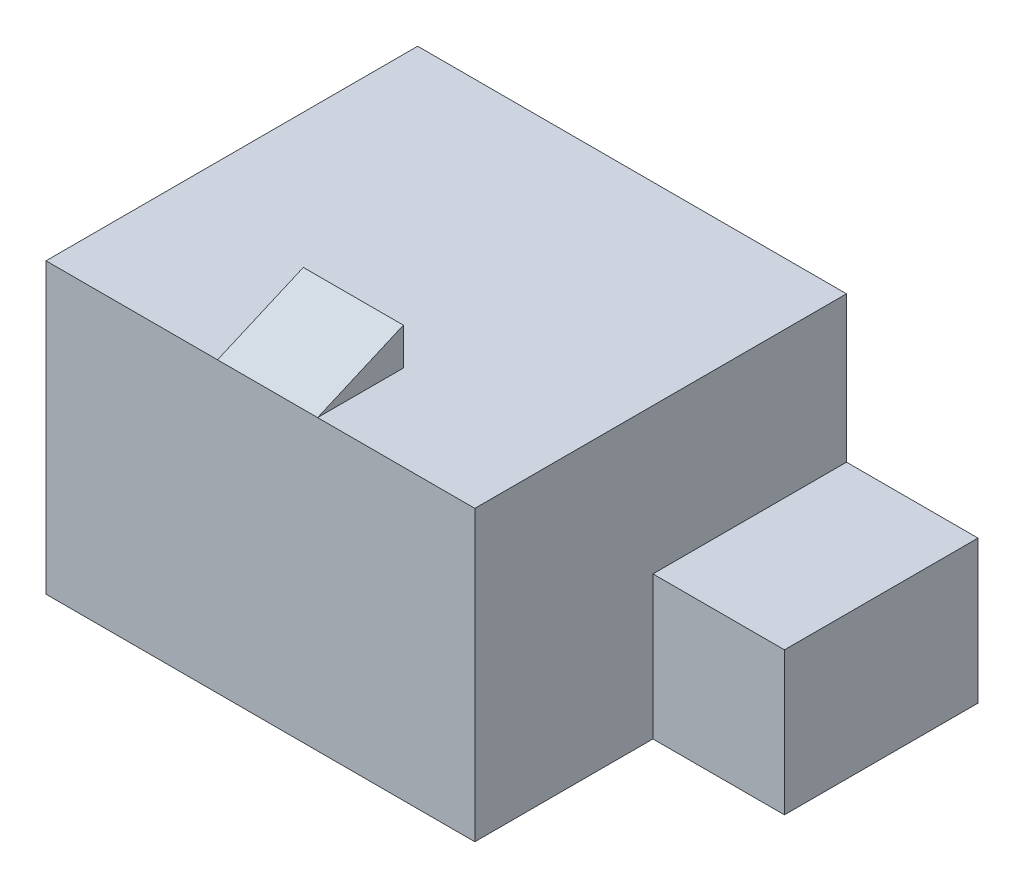
from build123d import *

# Parameters (mm, degrees)
SKETCH1_W           = 15
SKETCH1_H           = 13
BOSS_EXTRUDE1_DEPTH = 10.1
SKETCH2_W           = 3.5
SKETCH2_H           = 3
BOSS_EXTRUDE2_DEPTH = 1.3
CUT_EXTRUDE1_REACH  = 21.728
SKETCH4_W           = 6.77
SKETCH4_H           = 5
BOSS_EXTRUDE3_DEPTH = 4.6
SKETCH5_W           = 6.77
SKETCH5_H           = 5
BOSS_EXTRUDE4_DEPTH = 4.6


with BuildPart() as part:
    # Sketch1 → Boss-Extrude1 (new body)
    with BuildSketch(Plane(origin=(0, 0, 0), x_dir=(1, 0, 0), z_dir=(0, 1, 0))):
        with Locations((7.5, 6.5)):
            Rectangle(SKETCH1_W, SKETCH1_H)
    extrude(amount=BOSS_EXTRUDE1_DEPTH)

    # Sketch2 → Boss-Extrude2 (add)
    with BuildSketch(Plane(origin=(0, 10.1, 0), x_dir=(1, 0, 0), z_dir=(0, 1, 0))):
        with Locations((7.75, 1.5)):
            Rectangle(SKETCH2_W, SKETCH2_H)
    extrude(amount=BOSS_EXTRUDE2_DEPTH)

    # Sketch3 → Cut-Extrude1 (cut, up to next)
    with BuildSketch(Plane(origin=(9.5, 0, 0), x_dir=(0, 0, -1), z_dir=(1, 0, 0)), mode=Mode.PRIVATE) as cut_extrude1_sk1:
        Polygon((0, 10.1), (3, 11.4), (0, 11.4), align=None)
    cut_extrude1_tool1 = extrude(cut_extrude1_sk1.sketch, amount=-CUT_EXTRUDE1_REACH, mode=Mode.PRIVATE) & part.part
    add(cut_extrude1_tool1.solids().sort_by_distance((9.5, 10.966667, -1))[0], mode=Mode.SUBTRACT)

    # Sketch4 → Boss-Extrude3 (add)
    with BuildSketch(Plane(origin=(15, 0, 0), x_dir=(0, 0, -1), z_dir=(1, 0, 0))):
        with Locations((9.615, 2.5)):
            Rectangle(SKETCH4_W, SKETCH4_H)
    extrude(amount=BOSS_EXTRUDE3_DEPTH)

    # Sketch5 → Boss-Extrude4 (add)
    with BuildSketch(Plane.ZY):
        with Locations((-9.615, 2.5)):
            Rectangle(SKETCH5_W, SKETCH5_H)
    extrude(amount=BOSS_EXTRUDE4_DEPTH)


solid = part.part
